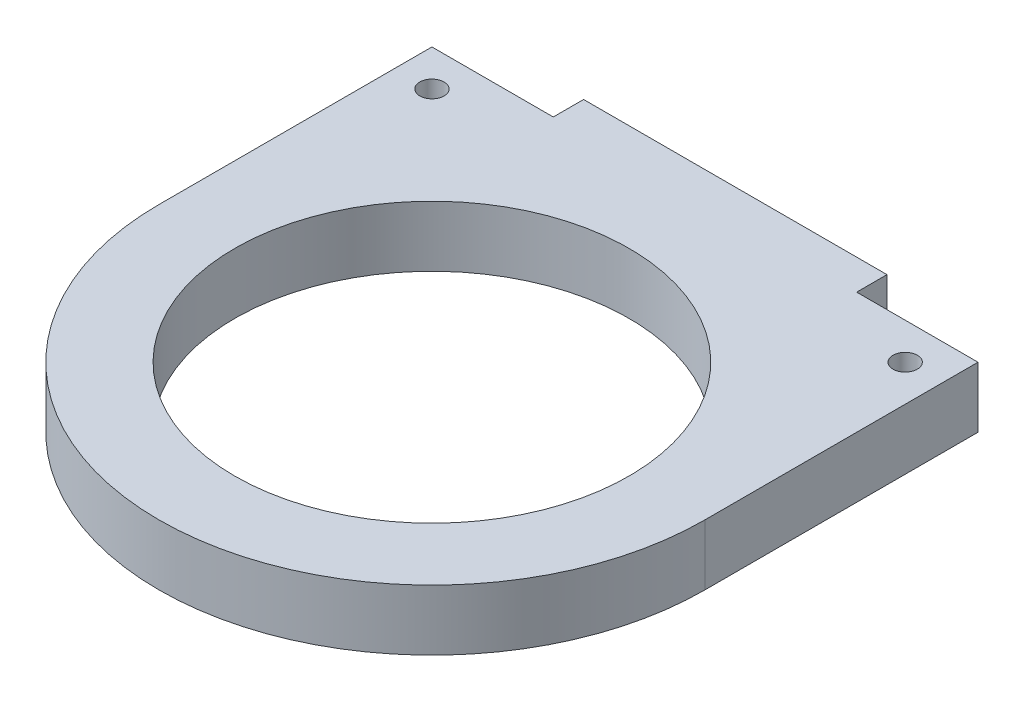
from build123d import *

# Parameters (mm, degrees)
SKETCH_1_R      = 32.5
SKETCH_1_R_2    = 2
EXTRUDE_1_DEPTH = 10


with BuildPart() as part:
    # 스케치1 → 보스-돌출1 (new body)
    with BuildSketch(Plane(origin=(0, 0, 0), x_dir=(1, 0, 0), z_dir=(0, 1, 0))):
        with BuildLine():
            Line((-25, 45), (-25, 50))
            Line((-25, 50), (25, 50))
            Line((25, 50), (25, 45))
            Line((25, 45), (45, 45))
            Line((45, 45), (45, 0))
            ThreePointArc((45, 0), (0, -45), (-45, 0))
            Line((-45, 0), (-45, 45))
            Line((-45, 45), (-25, 45))
        make_face()
        with Locations(Location((0, 0, 0), (0, 0, 270))):
            Circle(SKETCH_1_R, mode=Mode.SUBTRACT)
        with Locations(Location((-39, 39, 0), (0, 0, 270))):
            Circle(SKETCH_1_R_2, mode=Mode.SUBTRACT)
        with Locations(Location((39, 39, 0), (0, 0, 270))):
            Circle(SKETCH_1_R_2, mode=Mode.SUBTRACT)
    extrude(amount=EXTRUDE_1_DEPTH)


solid = part.part
